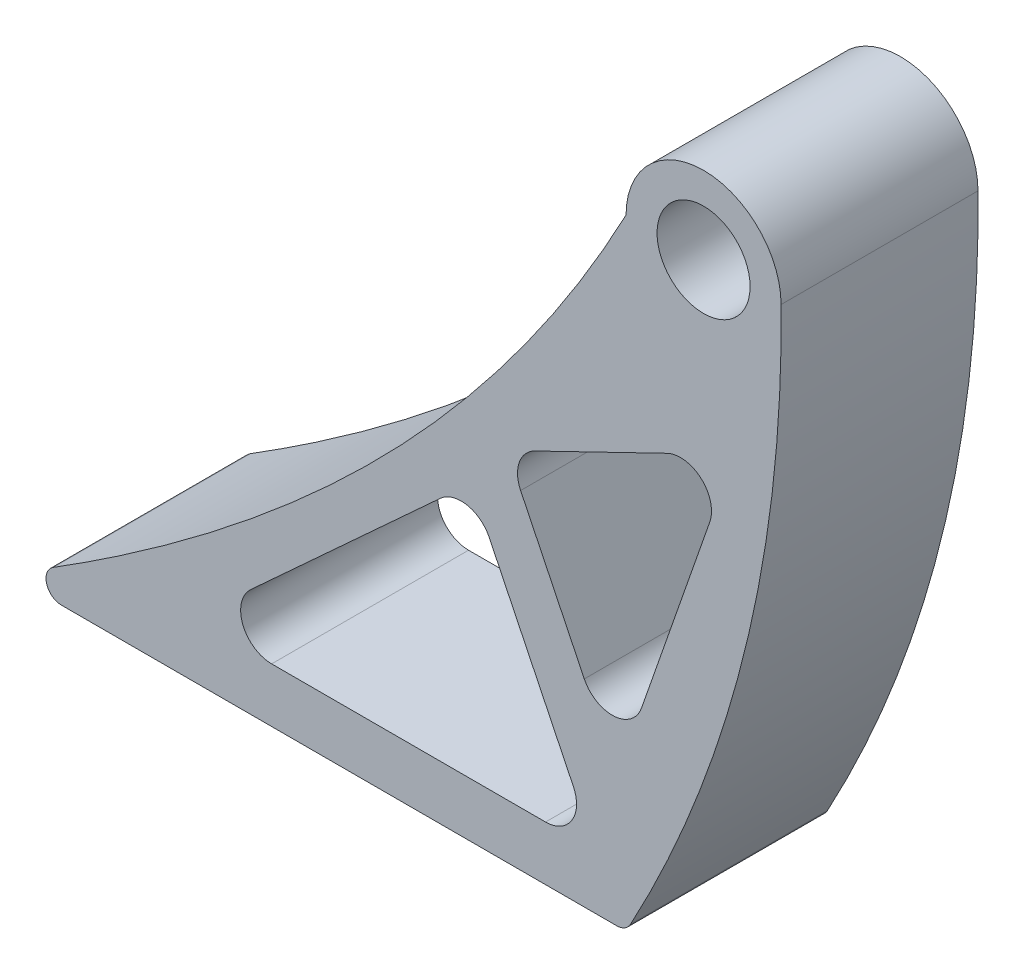
from build123d import *

# Parameters (mm, degrees)
CROQUIS2_R              = 3
SALIENTE_EXTRUIR1_DEPTH = 12.7


with BuildPart() as part:
    # Croquis2 → Saliente-Extruir1 (new body)
    with BuildSketch(Plane.XY):
        with BuildLine():
            Line((3.587738838, 0), (39.406158703, 0))
            ThreePointArc((39.406158703, 0), (39.918259557, 0.141074674), (40.285871489, 0.524494569))
            add(Edge.make_bspline(
                [(40.285871489, 0.524494569), (46.911013433, 12.781393637), (50.153045093, 25.954013269), (50, 40)],
                knots=[0.014077908, 0.014077908, 0.014077908, 0.014077908, 1, 1, 1, 1], degree=3))
            ThreePointArc((50, 40), (45, 45), (40, 40))
            add(Edge.make_bspline(
                [(3.057834867, 1.848057652), (18.658480945, 11.5960321), (31.500499666, 23.937674405), (40, 40)],
                knots=[0.060556777, 0.060556777, 0.060556777, 0.060556777, 1, 1, 1, 1], degree=3))
            ThreePointArc((3.057834867, 1.848057652), (2.626474657, 0.724371311), (3.587738838, 0))
        make_face()
        with Locations((45, 40)):
            Circle(CROQUIS2_R, mode=Mode.SUBTRACT)
        with BuildLine():
            Line((15.790154488, 6.97430828), (28.020474624, 18.185435072))
            ThreePointArc((28.020474624, 18.185435072), (29.74708418, 18.675625391), (31.171552095, 17.583673804))
            Line((31.171552095, 17.583673804), (36.607249933, 6.372547013))
            ThreePointArc((36.607249933, 6.372547013), (36.502480714, 4.438184109), (34.807621719, 3.5))
            Line((34.807621719, 3.5), (17.141603745, 3.5))
            ThreePointArc((17.141603745, 3.5), (15.277654099, 4.774953988), (15.790154488, 6.97430828))
        make_face(mode=Mode.SUBTRACT)
        with BuildLine():
            Line((37.307061828, 12.742351686), (33.200366798, 21.212410186))
            ThreePointArc((33.200366798, 21.212410186), (33.110481788, 22.740502603), (34.127447999, 23.884585413))
            Line((34.127447999, 23.884585413), (42.639921091, 28.011845094))
            ThreePointArc((42.639921091, 28.011845094), (44.843064134, 27.705372666), (45.400338187, 25.551954395))
            Line((45.400338187, 25.551954395), (40.994560126, 12.954636215))
            ThreePointArc((40.994560126, 12.954636215), (39.221637148, 11.61820464), (37.307061828, 12.742351686))
        make_face(mode=Mode.SUBTRACT)
    extrude(amount=SALIENTE_EXTRUIR1_DEPTH)


solid = part.part
